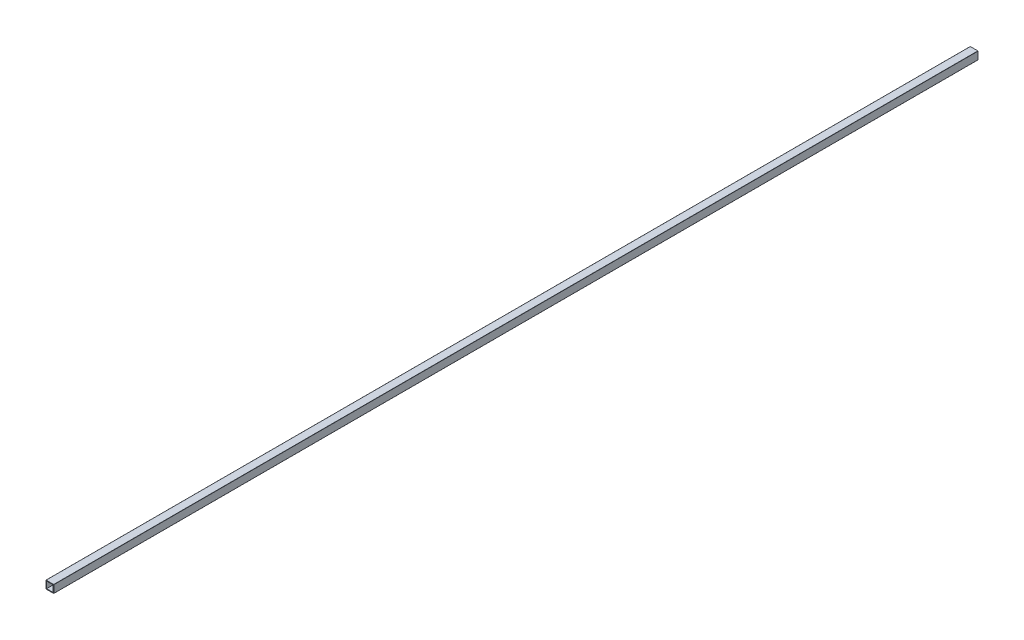
from build123d import *

# Parameters (mm, degrees)
CROQUIS1_W              = 43.2
CROQUIS1_H              = 43.2
SALIENTE_EXTRUIR1_DEPTH = 6000


with BuildPart() as part:
    # Croquis1 → Saliente-Extruir1 (new body)
    with BuildSketch(Plane.XY):
        with BuildLine():
            Line((-24.4, -25.4), (24.4, -25.4))
            ThreePointArc((24.4, -25.4), (25.107106781, -25.107106781), (25.4, -24.4))
            Line((25.4, -24.4), (25.4, 24.4))
            ThreePointArc((25.4, 24.4), (25.107106781, 25.107106781), (24.4, 25.4))
            Line((24.4, 25.4), (-24.4, 25.4))
            ThreePointArc((-24.4, 25.4), (-25.107106781, 25.107106781), (-25.4, 24.4))
            Line((-25.4, 24.4), (-25.4, -24.4))
            ThreePointArc((-25.4, -24.4), (-25.107106781, -25.107106781), (-24.4, -25.4))
        make_face()
        Rectangle(CROQUIS1_W, CROQUIS1_H, mode=Mode.SUBTRACT)
    extrude(amount=SALIENTE_EXTRUIR1_DEPTH)


solid = part.part
